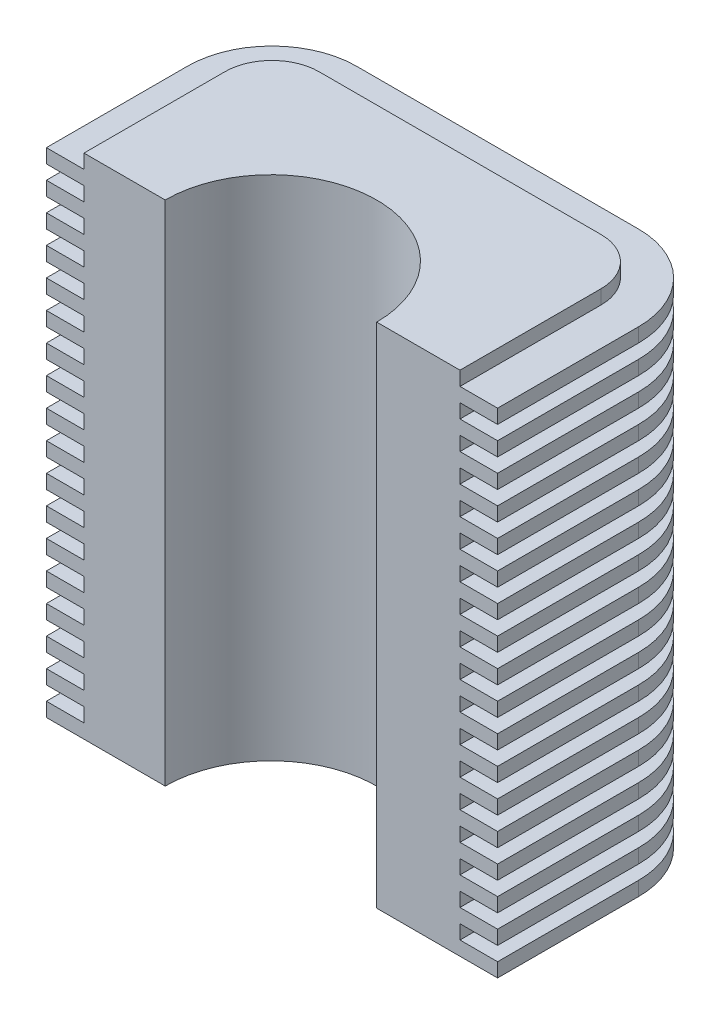
from build123d import *

# Parameters (mm, degrees)
DODANIE_WYCI_GNI_CIE1_DEPTH = 108
ZAOKR_GLENIE1_R             = 10
ZAOKR_GLENIE2_R             = 10
DODANIE_WYCI_GNI_CIE4_START = 3
DODANIE_WYCI_GNI_CIE4_DEPTH = 3
SZYK_LINIOWY1_COUNT         = 18
SZYK_LINIOWY1_PITCH         = 6


with BuildPart() as part:
    # Szkic1 → Dodanie-wyciągnięcie1 (new body)
    with BuildSketch(Plane(origin=(0, 0, 0), x_dir=(1, 0, 0), z_dir=(0, 1, 0))):
        with BuildLine():
            Line((-22.5, 0), (-39.780157198, 0))
            Line((-39.780157198, 0), (-39.780157198, 40))
            Line((-39.780157198, 40), (40.219842802, 40))
            Line((40.219842802, 40), (40.219842802, 0))
            Line((40.219842802, 0), (22.5, 0))
            ThreePointArc((22.5, 0), (0, 22.5), (-22.5, 0))
        make_face()
    extrude(amount=DODANIE_WYCI_GNI_CIE1_DEPTH)

    # Zaokrąglenie1
    zaokr_glenie1_edges = [part.edges().sort_by_distance(p)[0] for p in [
        (40.219842802, 54, -40),
    ]]
    fillet(zaokr_glenie1_edges, radius=ZAOKR_GLENIE1_R)

    # Zaokrąglenie2
    zaokr_glenie2_edges = [part.edges().sort_by_distance(p)[0] for p in [
        (-39.780157198, 54, -40),
    ]]
    fillet(zaokr_glenie2_edges, radius=ZAOKR_GLENIE2_R)

    # Szkic4 → Dodanie-wyciągnięcie4 (add)
    with BuildSketch(Plane(origin=(0, 0, 0), x_dir=(1, 0, 0), z_dir=(0, 1, 0)).offset(DODANIE_WYCI_GNI_CIE4_START)):
        with BuildLine():
            Line((40.219842802, 0), (40.219842802, 30))
            ThreePointArc((40.219842802, 30), (37.290910614, 37.071067812), (30.219842802, 40))
            Line((30.219842802, 40), (-29.780157198, 40))
            ThreePointArc((-29.780157198, 40), (-36.85122501, 37.071067812), (-39.780157198, 30))
            Line((-39.780157198, 30), (-39.780157198, 0))
            Line((-39.780157198, 0), (-47.780157198, 0))
            Line((-47.780157198, 0), (-47.780157198, 30))
            ThreePointArc((-47.780157198, 30), (-42.508079259, 42.727922061), (-29.780157198, 48))
            Line((-29.780157198, 48), (30.219842802, 48))
            ThreePointArc((30.219842802, 48), (42.947764864, 42.727922061), (48.219842802, 30))
            Line((48.219842802, 30), (48.219842802, 0))
            Line((48.219842802, 0), (40.219842802, 0))
        make_face()
    dodanie_wyci_gni_cie4 = extrude(amount=-DODANIE_WYCI_GNI_CIE4_DEPTH)

    # Szyk liniowy1: Dodanie-wyciągnięcie4 ×18
    with Locations(*[(0, i * SZYK_LINIOWY1_PITCH, 0) for i in range(1, SZYK_LINIOWY1_COUNT)]):
        add(dodanie_wyci_gni_cie4)


solid = part.part
